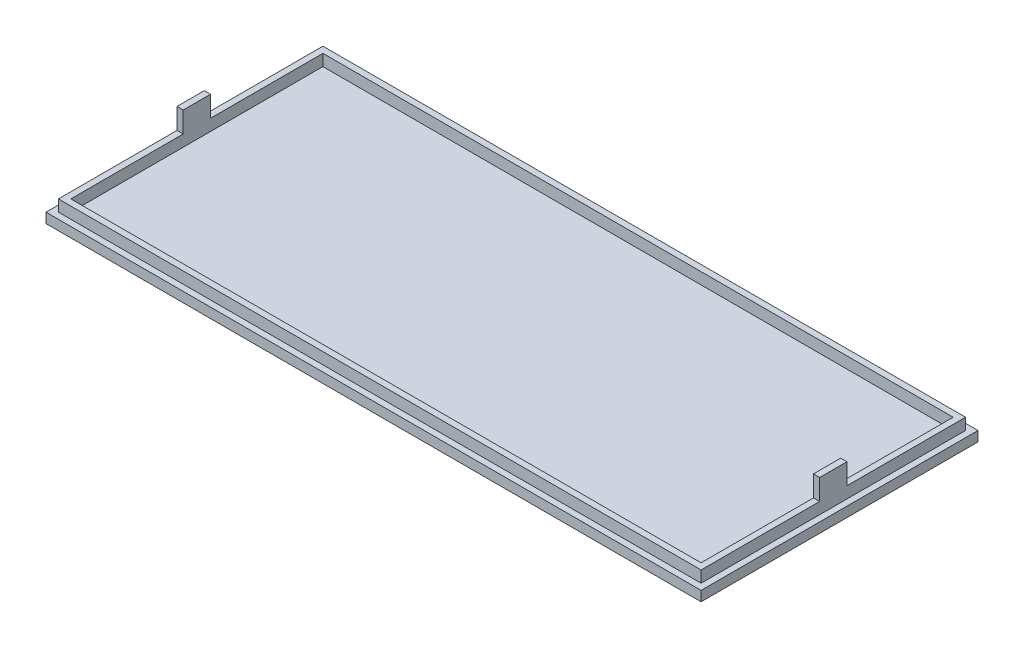
from build123d import *

# Parameters (mm, degrees)
SKETCH1_W           = 105.6
SKETCH1_H           = 44.64
BOSS_EXTRUDE1_DEPTH = 1.6
SKETCH1_3_W         = 103.6
SKETCH1_3_H         = 42.64
SKETCH1_3_W_2       = 101.6
SKETCH1_3_H_2       = 40.64
BOSS_EXTRUDE2_DEPTH = 3.45
SKETCH1_4_W         = 1
SKETCH1_4_H         = 4.4
BOSS_EXTRUDE3_DEPTH = 6.8


with BuildPart() as part:
    # Sketch1 → Boss-Extrude1 (new body)
    with BuildSketch(Plane(origin=(0, 0, 0), x_dir=(1, 0, 0), z_dir=(0, 1, 0))):
        with Locations((23.9, -7.945434783)):
            Rectangle(SKETCH1_W, SKETCH1_H)
    extrude(amount=BOSS_EXTRUDE1_DEPTH)

    # Sketch1<3> → Boss-Extrude2 (add)
    with BuildSketch(Plane(origin=(0, 0, 0), x_dir=(1, 0, 0), z_dir=(0, 1, 0))):
        with Locations((23.9, -7.945434783)):
            Rectangle(SKETCH1_3_W, SKETCH1_3_H)
        with Locations((23.9, -7.945434783)):
            Rectangle(SKETCH1_3_W_2, SKETCH1_3_H_2, mode=Mode.SUBTRACT)
    extrude(amount=BOSS_EXTRUDE2_DEPTH)

    # Sketch1<4> → Boss-Extrude3 (add)
    with BuildSketch(Plane(origin=(0, 0, 0), x_dir=(1, 0, 0), z_dir=(0, 1, 0))):
        with Locations((-27.4, -7.945434783)):
            Rectangle(SKETCH1_4_W, SKETCH1_4_H)
        with Locations((75.2, -7.945434783)):
            Rectangle(SKETCH1_4_W, SKETCH1_4_H)
    extrude(amount=BOSS_EXTRUDE3_DEPTH)


solid = part.part
